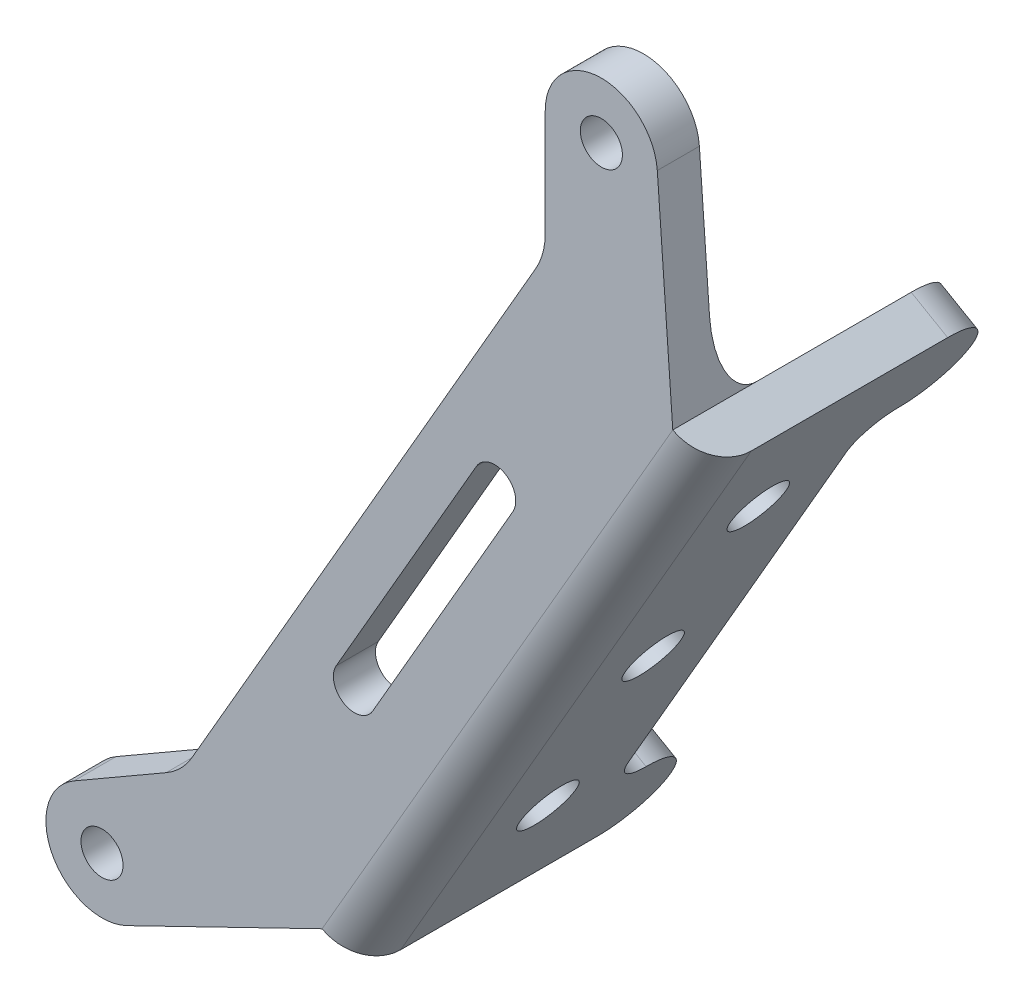
from build123d import *

# Parameters (mm, degrees)
SKETCH_1_R          = 1.5
EXTRUDE_1_DEPTH     = 3
CUT_EXTRUDE_1_DEPTH = 148.622791061
SKETCH_3_W          = 30
SKETCH_3_H          = 50
EXTRUDE_2_DEPTH     = 3
FILLET_1_R          = 3
SKETCH_4_R          = 2
CUT_EXTRUDE_2_DEPTH = 62.083894888
FILLET_2_R          = 5


with BuildPart() as part:
    # 草图1 → 凸台-拉伸1 (new body)
    with BuildSketch(Plane.XY):
        with BuildLine():
            ThreePointArc((74.735333077, -81.94640276), (73.202271099, -87.285997126), (78.48394402, -89.008053508))
            Line((78.48394402, -89.008053508), (92.427637923, -82.230635095))
            Line((92.427637923, -82.230635095), (117.427637923, -38.929364905))
            Line((117.427637923, -38.929364905), (116.32520749, -23.465062556))
            ThreePointArc((116.32520749, -23.465062556), (112.193026456, -19.752027824), (108.335333077, -23.749495625))
            Line((108.335333077, -23.749495625), (108.335333077, -32.677698856))
            Line((108.335333077, -32.677698856), (82.467383885, -77.482301144))
            Line((82.467383885, -77.482301144), (74.735333077, -81.94640276))
        make_face()
        with Locations((76.735333077, -85.410504375)):
            Circle(SKETCH_1_R, mode=Mode.SUBTRACT)
        with Locations((112.335333077, -23.749495625)):
            Circle(SKETCH_1_R, mode=Mode.SUBTRACT)
    extrude(amount=EXTRUDE_1_DEPTH)

    # 草图2 → 切除-拉伸1 (cut, through all)
    with BuildSketch(Plane.XY.offset(3)):
        with BuildLine():
            Line((93.432447394, -65.490254038), (103.432447394, -48.169745962))
            ThreePointArc((103.432447394, -48.169745962), (105.4814855, -47.620707856), (106.030523605, -49.669745962))
            Line((106.030523605, -49.669745962), (96.030523605, -66.990254038))
            ThreePointArc((96.030523605, -66.990254038), (93.9814855, -67.539292144), (93.432447394, -65.490254038))
        make_face()
    extrude(amount=-CUT_EXTRUDE_1_DEPTH, mode=Mode.SUBTRACT)

    # 草图3 → 凸台-拉伸2 (add)
    with BuildSketch(Plane(origin=(104.927637923, -60.58, 0), x_dir=(0, 0, -1), z_dir=(0.8660254037844419, -0.4999999999999942, 0))):
        with Locations((12, 0)):
            Rectangle(SKETCH_3_W, SKETCH_3_H)
    extrude(amount=EXTRUDE_2_DEPTH)

    # 圆角1
    fillet_1_edges = [part.edges().sort_by_distance(p)[0] for p in [
        (107.525714134, -62.08, 3),
        (104.927637923, -60.58, 0),
    ]]
    fillet(fillet_1_edges, radius=FILLET_1_R)

    # 草图4 → 切除-拉伸2 (cut, through all)
    with BuildSketch(Plane(origin=(107.525714134, -62.08, 0), x_dir=(0, 0, -1), z_dir=(0.8660254037844419, -0.4999999999999943, 0))):
        with BuildLine():
            Line((27, -25), (27, 25))
            Line((27, 25), (14, 25))
            ThreePointArc((14, 25), (17.5, 21.5), (14, 18))
            ThreePointArc((14, 18), (12.232233047, 17.267766953), (11.5, 15.5))
            Line((11.5, 15.5), (11.5, -15.5))
            ThreePointArc((11.5, -15.5), (12.232233047, -17.267766953), (14, -18))
            ThreePointArc((14, -18), (17.5, -21.5), (14, -25))
            Line((14, -25), (27, -25))
        make_face()
        with Locations(Location((5.5, 0, 0), (0, 0, 90))):
            Circle(SKETCH_4_R)
        with Locations(Location((5.5, 15, 0), (0, 0, 90))):
            Circle(SKETCH_4_R)
        with Locations(Location((5.5, -15, 0), (0, 0, 90))):
            Circle(SKETCH_4_R)
    extrude(amount=-CUT_EXTRUDE_2_DEPTH, mode=Mode.SUBTRACT)

    # 圆角2
    fillet_2_edges = [part.edges().sort_by_distance(p)[0] for p in [
        (82.467383885, -77.482301144, 1.5),
        (108.335333077, -32.677698856, 1.5),
    ]]
    fillet(fillet_2_edges, radius=FILLET_2_R)


solid = part.part
